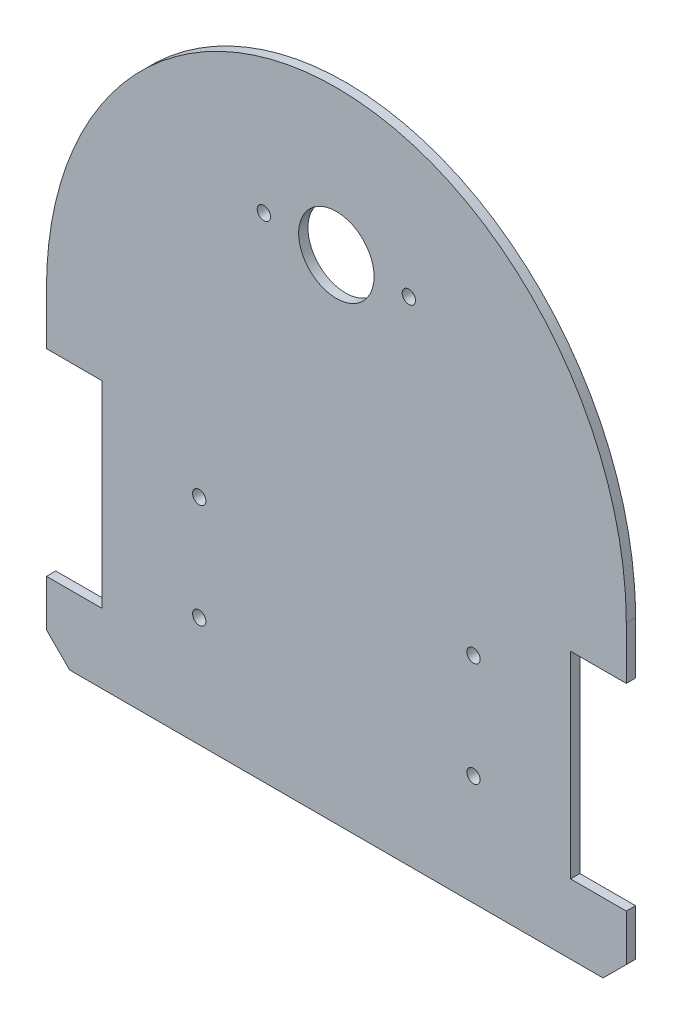
from build123d import *

# Parameters (mm, degrees)
SKETCH1_W           = 100
SKETCH1_H           = 110
BOSS_EXTRUDE1_DEPTH = 1.6
CUT_EXTRUDE1_DEPTH  = 75.347562166
SKETCH3_W           = 9.6
SKETCH3_H           = 34
CUT_EXTRUDE2_DEPTH  = 75.347562309
CHAMFER1_SIZE       = 4
SKETCH4_R           = 6.5
CUT_EXTRUDE3_DEPTH  = 75.347562309
SKETCH5_R           = 1.15
CUT_EXTRUDE4_DEPTH  = 75.347562309
SKETCH6_R           = 1.15
CUT_EXTRUDE5_DEPTH  = 75.347562309


with BuildPart() as part:
    # Sketch1 → Boss-Extrude1 (new body)
    with BuildSketch(Plane.XY):
        Rectangle(SKETCH1_W, SKETCH1_H)
    extrude(amount=BOSS_EXTRUDE1_DEPTH)

    # Sketch2 → Cut-Extrude1 (cut, through all)
    with BuildSketch(Plane.XY.offset(1.6)):
        with BuildLine():
            Line((-50, 0), (-70, 0))
            Line((-70, 0), (-70, 70))
            Line((-70, 70), (70, 70))
            Line((70, 70), (70, 0))
            Line((70, 0), (50, 0))
            add(Edge.make_bspline(
                [(50, 0), (50, 55), (0, 55), (-50, 55), (-50, 0)],
                knots=[1.570796327, 1.570796327, 1.570796327, 3.141592654, 3.141592654, 4.71238898, 4.71238898, 4.71238898], degree=2, weights=[1, 0.707106781, 1, 0.707106781, 1]))
        make_face()
    extrude(amount=-CUT_EXTRUDE1_DEPTH, mode=Mode.SUBTRACT)

    # Sketch3 → Cut-Extrude2 (cut, through all)
    with BuildSketch(Plane.XY.offset(1.6)):
        with Locations((-45.2, -26)):
            Rectangle(SKETCH3_W, SKETCH3_H)
        with Locations((45.2, -26)):
            Rectangle(SKETCH3_W, SKETCH3_H)
    extrude(amount=-CUT_EXTRUDE2_DEPTH, mode=Mode.SUBTRACT)

    # Chamfer1
    chamfer1_edges = [part.edges().sort_by_distance(p)[0] for p in [
        (50, -55, 0.8),
        (-50, -55, 0.8),
    ]]
    chamfer(chamfer1_edges, length=CHAMFER1_SIZE)

    # Sketch4 → Cut-Extrude3 (cut, through all)
    with BuildSketch(Plane.XY.offset(1.6)):
        with Locations((0, 30)):
            Circle(SKETCH4_R)
    extrude(amount=-CUT_EXTRUDE3_DEPTH, mode=Mode.SUBTRACT)

    # Sketch5 → Cut-Extrude4 (cut, through all)
    with BuildSketch(Plane.XY.offset(1.6)):
        with Locations((-23.649987564, -18)):
            Circle(SKETCH5_R)
        with Locations((-23.649987564, -36)):
            Circle(SKETCH5_R)
        with Locations(Location((23.649987564, -36, 0), (0, 0, 180))):
            Circle(SKETCH5_R)
        with Locations(Location((23.649987564, -18, 0), (0, 0, 180))):
            Circle(SKETCH5_R)
    extrude(amount=-CUT_EXTRUDE4_DEPTH, mode=Mode.SUBTRACT)

    # Sketch6 → Cut-Extrude5 (cut, through all)
    with BuildSketch(Plane.XY.offset(1.6)):
        with Locations((-12.5, 30)):
            Circle(SKETCH6_R)
        with Locations((12.5, 30)):
            Circle(SKETCH6_R)
    extrude(amount=-CUT_EXTRUDE5_DEPTH, mode=Mode.SUBTRACT)


solid = part.part
